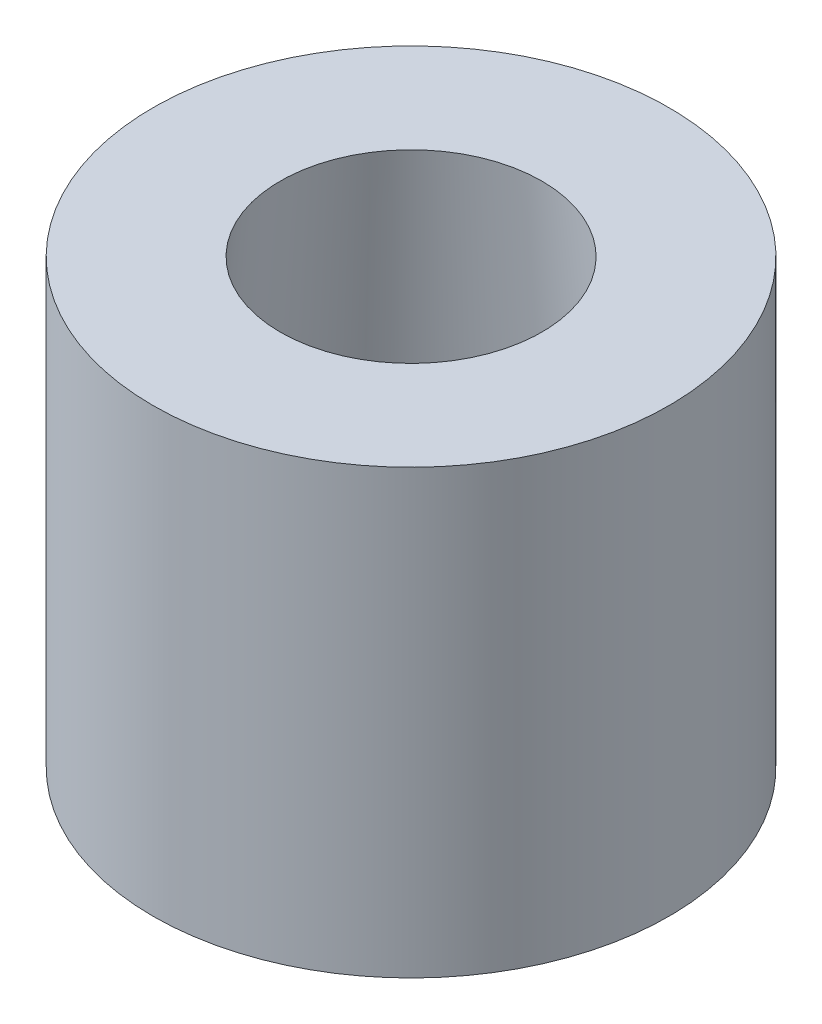
from build123d import *

# Parameters (mm, degrees)
SKETCH2_R           = 17.5
BOSS_EXTRUDE2_DEPTH = 30
SKETCH3_R           = 11.5
CUT_EXTRUDE1_DEPTH  = 30
CUT_EXTRUDE1_DRAFT  = -5
SKETCH4_R           = 15
SKETCH4_R_2         = 12.5
CUT_EXTRUDE2_DEPTH  = 5


with BuildPart() as part:
    # Sketch2 → Boss-Extrude2 (new body)
    with BuildSketch(Plane(origin=(0, 0, 0), x_dir=(1, 0, 0), z_dir=(0, 1, 0))):
        with Locations(Location((0, 0, 0), (0, 0, 270))):
            Circle(SKETCH2_R)
    extrude(amount=BOSS_EXTRUDE2_DEPTH)


with BuildPart() as cut_extrude1_tool:
    # Sketch3 → Cut-Extrude1 (with draft: the straight prism first)
    with BuildSketch(Plane.XZ):
        Circle(SKETCH3_R)
    extrude(amount=-CUT_EXTRUDE1_DEPTH)
    # Cut-Extrude1: the draft: its side faces are tilted about the plane it starts from
    cut_extrude1_sides = [cut_extrude1_tool.faces().sort_by_distance(p)[0] for p in [
        (-11.5, 15, 0),
    ]]
    draft(cut_extrude1_sides, Plane.XZ, CUT_EXTRUDE1_DRAFT)


with BuildPart() as part_1:
    add(part.part)

    # Cut-Extrude1: cut by cut_extrude1_tool
    add(cut_extrude1_tool.part, mode=Mode.SUBTRACT)

    # Sketch4 → Cut-Extrude2 (cut)
    with BuildSketch(Plane.XZ):
        with Locations(Location((0, 0.439504446, 0), (0, 0, 270))):
            Circle(SKETCH4_R)
        with Locations(Location((0, 0.439504446, 0), (0, 0, 270))):
            Circle(SKETCH4_R_2, mode=Mode.SUBTRACT)
    extrude(amount=-CUT_EXTRUDE2_DEPTH, mode=Mode.SUBTRACT)


solid = part_1.part
